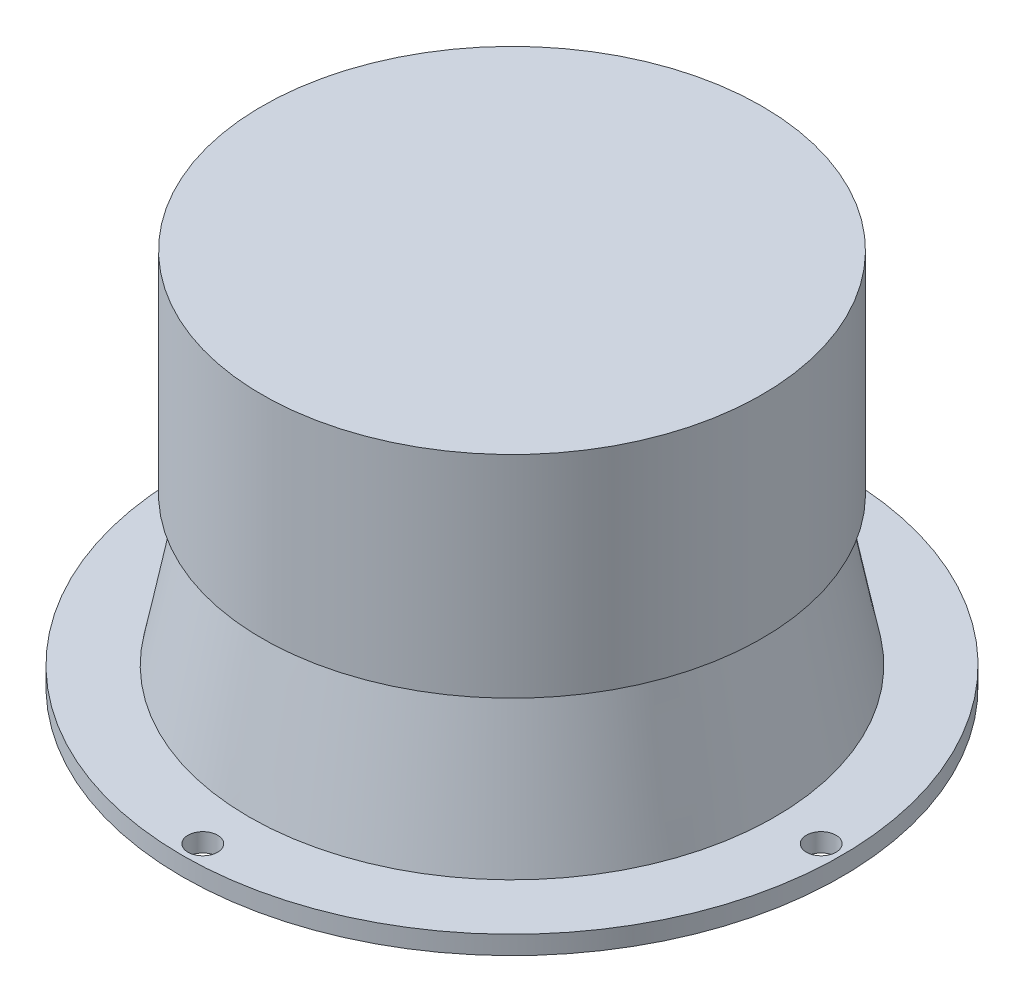
from build123d import *

# Parameters (mm, degrees)
SKETCH1_R           = 44.5
SKETCH1_R_2         = 2
BOSS_EXTRUDE1_DEPTH = 2.5
SKETCH2_R           = 34
BOSS_EXTRUDE2_DEPTH = 1
SKETCH3_R           = 35.5
BOSS_EXTRUDE3_DEPTH = 20
BOSS_EXTRUDE3_TAPER = 11
SKETCH4_R           = 33.75
BOSS_EXTRUDE4_DEPTH = 28.5


with BuildPart() as part:
    # Sketch1 → Boss-Extrude1 (new body)
    with BuildSketch(Plane(origin=(0, 0, 0), x_dir=(1, 0, 0), z_dir=(0, 1, 0))):
        with Locations(Location((0, 0, 0), (0, 0, 270))):
            Circle(SKETCH1_R)
        with Locations(Location((0, 41.75, 0), (0, 0, 270))):
            Circle(SKETCH1_R_2, mode=Mode.SUBTRACT)
        with Locations(Location((41.75, 0, 0), (0, 0, 270))):
            Circle(SKETCH1_R_2, mode=Mode.SUBTRACT)
        with Locations(Location((0, -41.75, 0), (0, 0, 270))):
            Circle(SKETCH1_R_2, mode=Mode.SUBTRACT)
        with Locations(Location((-41.75, 0, 0), (0, 0, 270))):
            Circle(SKETCH1_R_2, mode=Mode.SUBTRACT)
    extrude(amount=BOSS_EXTRUDE1_DEPTH)

    # Sketch2 → Boss-Extrude2 (add)
    with BuildSketch(Plane(origin=(0, 0, 0), x_dir=(-1, 0, 0), z_dir=(0, -1, 0))):
        with Locations(Location((0, 0, 0), (0, 0, 90))):
            Circle(SKETCH2_R)
    extrude(amount=BOSS_EXTRUDE2_DEPTH)

    # Sketch3 → Boss-Extrude3 (add)
    with BuildSketch(Plane(origin=(0, 2.5, 0), x_dir=(1, 0, 0), z_dir=(0, 1, 0))):
        Circle(SKETCH3_R)
    extrude(amount=BOSS_EXTRUDE3_DEPTH, taper=BOSS_EXTRUDE3_TAPER)

    # Sketch4 → Boss-Extrude4 (add)
    with BuildSketch(Plane(origin=(0, 22.5, 0), x_dir=(1, 0, 0), z_dir=(0, 1, 0))):
        with Locations(Location((0, 0, 0), (0, 0, 90))):
            Circle(SKETCH4_R)
    extrude(amount=BOSS_EXTRUDE4_DEPTH)


solid = part.part
